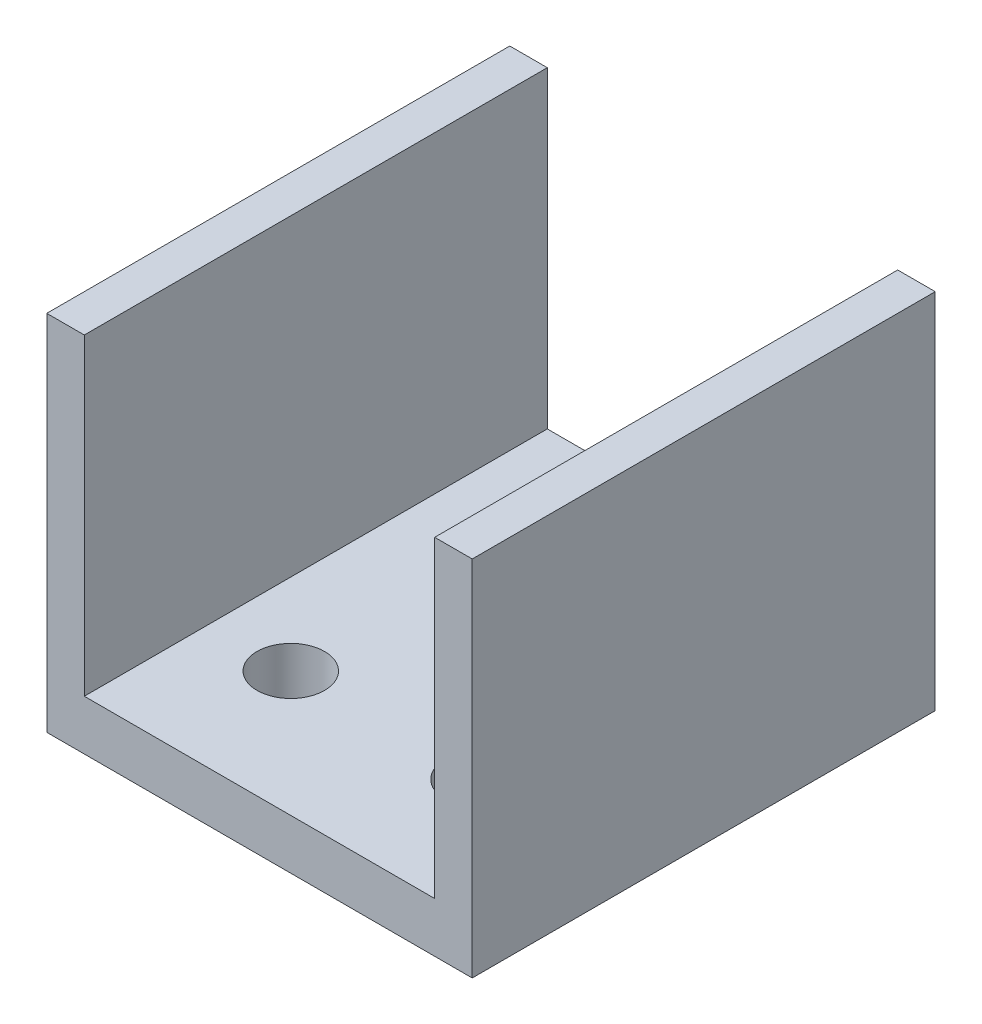
from build123d import *

# Parameters (mm, degrees)
SKETCH1_W            = 34
SKETCH1_H            = 37
SKETCH1_R            = 2.7
BOSS_EXTRUDE1_DEPTH  = 4
SKETCH30_W           = 37
SKETCH30_H           = 25
BOSS_EXTRUDE19_DEPTH = 3
SKETCH31_W           = 37
SKETCH31_H           = 25
BOSS_EXTRUDE20_DEPTH = 3


with BuildPart() as part:
    # Sketch1 → Boss-Extrude1 (new body)
    with BuildSketch(Plane(origin=(0, 0, 0), x_dir=(1, 0, 0), z_dir=(0, 1, 0))):
        with Locations((-18.825390803, 9.424231459)):
            Rectangle(SKETCH1_W, SKETCH1_H)
        with Locations(Location((-18.825390803, 20.924231459, 0), (0, 0, 270))):
            Circle(SKETCH1_R, mode=Mode.SUBTRACT)
        with Locations(Location((-11.325390803, 0.924231459, 0), (0, 0, 270))):
            Circle(SKETCH1_R, mode=Mode.SUBTRACT)
        with Locations(Location((-26.325390803, 0.924231459, 0), (0, 0, 90))):
            Circle(SKETCH1_R, mode=Mode.SUBTRACT)
    extrude(amount=BOSS_EXTRUDE1_DEPTH)

    # Sketch30 → Boss-Extrude19 (add)
    with BuildSketch(Plane.ZY.offset(35.825390803)):
        with Locations((-9.424231459, 16.5)):
            Rectangle(SKETCH30_W, SKETCH30_H)
    extrude(amount=-BOSS_EXTRUDE19_DEPTH)

    # Sketch31 → Boss-Extrude20 (add)
    with BuildSketch(Plane(origin=(-1.825390803, 0, 0), x_dir=(0, 0, -1), z_dir=(1, 0, 0))):
        with Locations((9.424231459, 16.5)):
            Rectangle(SKETCH31_W, SKETCH31_H)
    extrude(amount=-BOSS_EXTRUDE20_DEPTH)


solid = part.part
